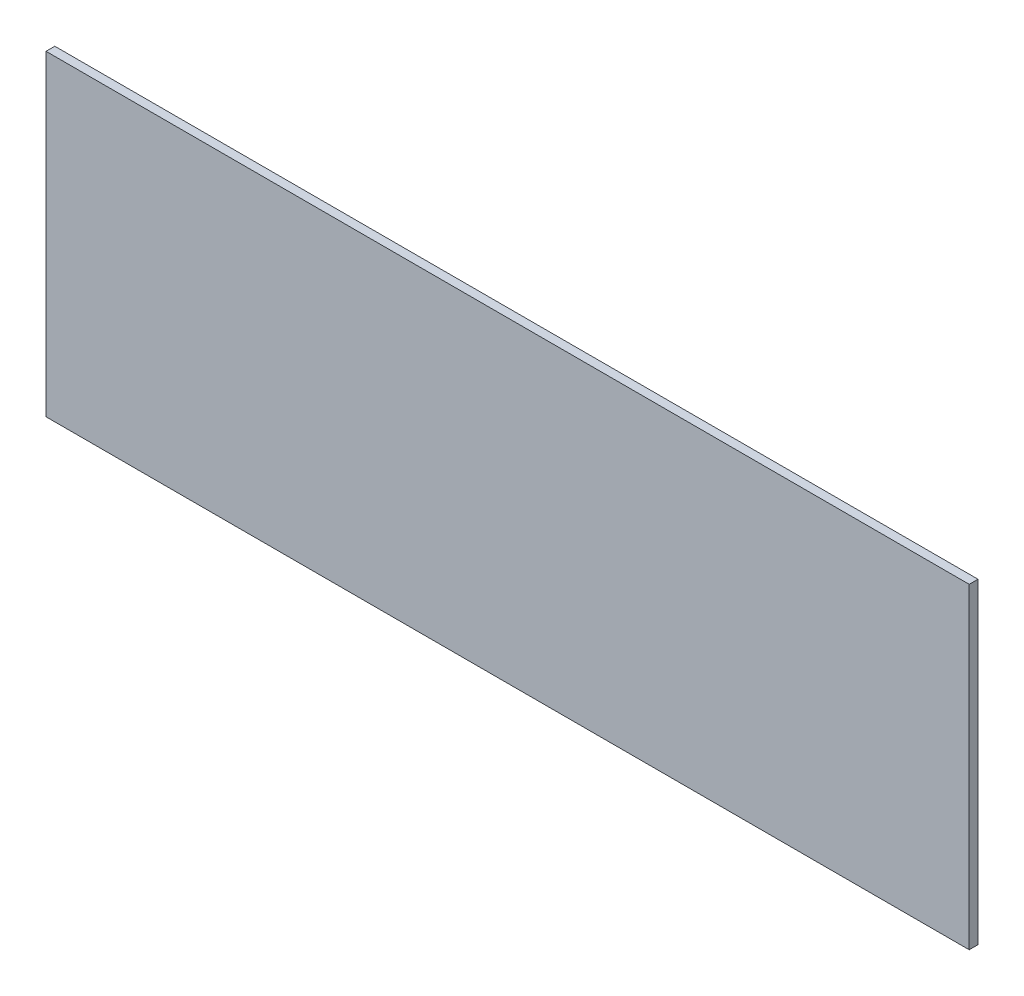
from build123d import *

# Parameters (mm, degrees)
SKETCH1_W           = 210
SKETCH1_H           = 72
BOSS_EXTRUDE1_DEPTH = 2


with BuildPart() as part:
    # Sketch1 → Boss-Extrude1 (new body)
    with BuildSketch(Plane.XY):
        Rectangle(SKETCH1_W, SKETCH1_H)
    extrude(amount=BOSS_EXTRUDE1_DEPTH)


solid = part.part
